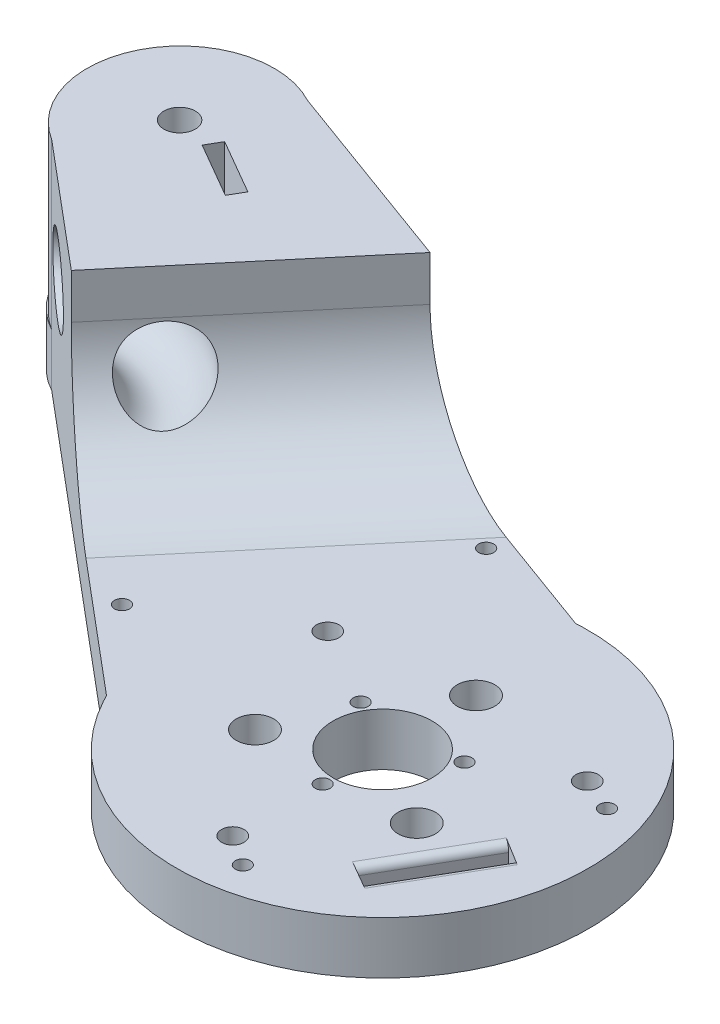
from build123d import *

# Parameters (mm, degrees)
SKETCH_1_R           = 27.5
SKETCH_1_R_2         = 6.6
SKETCH_1_R_3         = 1.3
EXTRUDE_1_DEPTH      = 7
SKETCH_2_R           = 2.5
CUT_EXTRUDE_2_DEPTH  = 5
SKETCH_4_R           = 1
CUT_EXTRUDE_3_DEPTH  = 6
SKETCH_5_R           = 1.5
CUT_EXTRUDE_4_DEPTH  = 50.019507543
CUT_EXTRUDE_5_DEPTH  = 2.7
CUT_EXTRUDE_6_DEPTH  = 10
FILLET_1_R           = 1
SKETCH_9_R           = 2.1
EXTRUDE_3_DEPTH      = 7
SKETCH_13_R          = 1
CUT_EXTRUDE_9_DEPTH  = 88.1614895
SKETCH_14_R          = 2.1
EXTRUDE_4_DEPTH      = 22
FILLET_2_R           = 16
SKETCH_15_R          = 1.5
CUT_EXTRUDE_10_DEPTH = 91.308323515
SKETCH_16_R          = 3
CUT_EXTRUDE_11_DEPTH = 3
SKETCH_17_R          = 5


with BuildPart() as part:
    # 草图1 → 凸台-拉伸1 (new body)
    with BuildSketch(Plane(origin=(0, 0, 0), x_dir=(1, 0, 0), z_dir=(0, 1, 0))):
        with Locations(Location((0, -12.470765814, 0), (0, 0, 270))):
            Circle(SKETCH_1_R)
        with Locations(Location((0, -12.470765814, 0), (0, 0, 270))):
            Circle(SKETCH_1_R_2, mode=Mode.SUBTRACT)
        with Locations(Location((-10.8, -18.706148722, 0), (0, 0, 270))):
            Circle(SKETCH_1_R_3, mode=Mode.SUBTRACT)
        with Locations(Location((10.8, -18.706148722, 0), (0, 0, 270))):
            Circle(SKETCH_1_R_3, mode=Mode.SUBTRACT)
        with Locations(Location((0, 0, 0), (0, 0, 270))):
            Circle(SKETCH_1_R_3, mode=Mode.SUBTRACT)
    extrude(amount=EXTRUDE_1_DEPTH)

    # 草图2 → 切除-拉伸2 (cut)
    with BuildSketch(Plane(origin=(0, 7, 0), x_dir=(1, 0, 0), z_dir=(0, 1, 0))):
        with Locations(Location((-10.8, -18.706148722, 0), (0, 0, 270))):
            Circle(SKETCH_2_R)
        with Locations(Location((10.8, -18.706148722, 0), (0, 0, 270))):
            Circle(SKETCH_2_R)
        with Locations(Location((0, 0, 0), (0, 0, 270))):
            Circle(SKETCH_2_R)
    extrude(amount=-CUT_EXTRUDE_2_DEPTH, mode=Mode.SUBTRACT)

    # 草图4 → 切除-拉伸3 (cut)
    with BuildSketch(Plane(origin=(0, 7, 0), x_dir=(1, 0, 0), z_dir=(0, 1, 0))):
        with Locations(Location((-6.92820323, -8.470765814, 0), (0, 0, 270))):
            Circle(SKETCH_4_R)
        with Locations(Location((6.92820323, -8.470765814, 0), (0, 0, 90))):
            Circle(SKETCH_4_R)
        with Locations(Location((0, -20.470765814, 0), (0, 0, 270))):
            Circle(SKETCH_4_R)
    extrude(amount=-CUT_EXTRUDE_3_DEPTH, mode=Mode.SUBTRACT)

    # 草图5 → 切除-拉伸4 (cut, through all)
    with BuildSketch(Plane(origin=(0, 7, 0), x_dir=(1, 0, 0), z_dir=(0, 1, 0))):
        with Locations(Location((-17.320508076, -2.470765814, 0), (0, 0, 270))):
            Circle(SKETCH_5_R)
        with Locations(Location((0, -32.470765814, 0), (0, 0, 270))):
            Circle(SKETCH_5_R)
        with Locations(Location((17.320508076, -2.470765814, 0), (0, 0, 270))):
            Circle(SKETCH_5_R)
    extrude(amount=-CUT_EXTRUDE_4_DEPTH, mode=Mode.SUBTRACT)

    # 草图6 → 切除-拉伸5 (cut)
    with BuildSketch(Plane.XZ):
        Polygon((3.290896534, 32.470765814), (1.645448267, 35.320765814), (-1.645448267, 35.320765814), (-3.290896534, 32.470765814), (-1.645448267, 29.620765814), (1.645448267, 29.620765814), align=None)
        Polygon((20.61140461, 2.470765814), (18.965956343, 5.320765814), (15.675059808, 5.320765814), (14.029611541, 2.470765814), (15.675059808, -0.379234186), (18.965956343, -0.379234186), align=None)
        Polygon((-14.029611541, 2.470765814), (-15.675059808, 5.320765814), (-18.965956343, 5.320765814), (-20.61140461, 2.470765814), (-18.965956343, -0.379234186), (-15.675059808, -0.379234186), align=None)
    extrude(amount=-CUT_EXTRUDE_5_DEPTH, mode=Mode.SUBTRACT)

    # 草图7 → 切除-拉伸6 (cut)
    with BuildSketch(Plane(origin=(0, 7, 0), x_dir=(1, 0, 0), z_dir=(0, 1, 0))):
        Polygon((19.338457268, -14.975575286), (11.838457268, -27.965956343), (14.003520778, -29.215956343), (21.468764488, -16.285774946), align=None)
    extrude(amount=-CUT_EXTRUDE_6_DEPTH, mode=Mode.SUBTRACT)

    # 圆角1
    fillet_1_edges = [part.edges().sort_by_distance(p)[0] for p in [
        (15.588457268, 0, 21.470765814),
        (17.736142633, 0, 22.750865644),
        (15.588457268, 7, 21.470765814),
        (17.736142633, 7, 22.750865644),
    ]]
    fillet(fillet_1_edges, radius=FILLET_1_R)

    # 草图9 → 凸台-拉伸3 (add)
    with BuildSketch(Plane.XZ):
        with BuildLine():
            Line((-24.637772228, 24.686746318), (-70.563132874, -13.924926133))
            ThreePointArc((-70.563132874, -13.924926133), (-75.458515455, -31.192547657), (-58.048161541, -35.553178381))
            Line((-58.048161541, -35.553178381), (-1.686469289, -14.977473133))
            Line((-1.686469289, -14.977473133), (-0.82500702, -15.016856189))
            Line((-0.82500702, -15.016856189), (-16.980808265, -9.160280176))
            Line((-16.980808265, -9.160280176), (-27.376809202, 9.870704679))
            Line((-27.376809202, 9.870704679), (-24.198243857, 25.535795253))
            Line((-24.198243857, 25.535795253), (-24.637772228, 24.686746318))
        make_face()
        with Locations(Location((-64.305647208, -24.739052257, 0), (0, 0, 270))):
            Circle(SKETCH_9_R, mode=Mode.SUBTRACT)
        Polygon((-58.808031517, -25.255019032), (-51.450927664, -20.997904645), (-52.552769035, -19.09371306), (-59.909872887, -23.350827447), align=None, mode=Mode.SUBTRACT)
    extrude(amount=-EXTRUDE_3_DEPTH)

    # 草图13 → 切除-拉伸9 (cut, through all)
    with BuildSketch(Plane(origin=(0, 7, 0), x_dir=(1, 0, 0), z_dir=(0, 1, 0))):
        with Locations(Location((4.029784687, -35.157765041, 0), (0, 0, 270))):
            Circle(SKETCH_13_R)
        with Locations(Location((21.824784687, -4.33592092, 0), (0, 0, 270))):
            Circle(SKETCH_13_R)
        with Locations(Location((-16.340954858, 17.69907908, 0), (0, 0, 270))):
            Circle(SKETCH_13_R)
        with Locations(Location((-34.135954858, -13.122765041, 0), (0, 0, 270))):
            Circle(SKETCH_13_R)
    extrude(amount=-CUT_EXTRUDE_9_DEPTH, mode=Mode.SUBTRACT)

    # 草图14 → 凸台-拉伸4 (add)
    with BuildSketch(Plane(origin=(0, 7, 0), x_dir=(1, 0, 0), z_dir=(0, 1, 0))):
        with BuildLine():
            Line((-70.563132874, 13.924926133), (-54.154588064, 0.129468707))
            Line((-54.154588064, 0.129468707), (-32.28086935, 26.146430855))
            Line((-32.28086935, 26.146430855), (-58.048161541, 35.553178381))
            ThreePointArc((-58.048161541, 35.553178381), (-74.791319703, 30.806481525), (-70.563132874, 13.924926133))
        make_face()
        with Locations(Location((-64.305647208, 24.739052257, 0), (0, 0, 90))):
            Circle(SKETCH_14_R, mode=Mode.SUBTRACT)
        Polygon((-58.808031517, 25.255019032), (-59.909872887, 23.350827447), (-52.552769035, 19.09371306), (-51.450927664, 20.997904645), align=None, mode=Mode.SUBTRACT)
    extrude(amount=EXTRUDE_4_DEPTH)

    # 圆角2
    fillet_2_edges = [part.edges().sort_by_distance(p)[0] for p in [
        (-43.217728707, 7, -13.137949781),
    ]]
    fillet(fillet_2_edges, radius=FILLET_2_R)

    # 草图15 → 切除-拉伸10 (cut, through all)
    with BuildSketch(Plane(origin=(-3.803339533, 0, 6.572894544), x_dir=(0.8655416297077619, 0, 0.5008369866961021), z_dir=(-0.5008369866961021, 0, 0.865541629707762))):
        with Locations(Location((-54.416791824, 23.665181086, 0), (0, 0, 245.053604138))):
            Circle(SKETCH_15_R)
    extrude(amount=-CUT_EXTRUDE_10_DEPTH, mode=Mode.SUBTRACT)

    # 草图16 → 切除-拉伸11 (cut)
    with BuildSketch(Plane(origin=(4.626421242, 0, -12.672855056), x_dir=(-0.9393615375389992, 0, -0.3429284207999792), z_dir=(0.3429284207999792, 0, -0.9393615375389992))):
        with Locations((53.038314469, 23.665181086)):
            Circle(SKETCH_16_R)
    extrude(amount=-CUT_EXTRUDE_11_DEPTH, mode=Mode.SUBTRACT)

    # 草图17 → 切除-旋转1 (revolve, cut)
    with BuildSketch(Plane(origin=(-31.791422565, 0, -26.728586941), x_dir=(0.6435278741872098, 0, -0.7654226774430521), z_dir=(0.7654226774430521, 0, 0.6435278741872098)), mode=Mode.PRIVATE) as cut_revolve_1_sk:
        with Locations((-25.901195998, 17.59703733)):
            Circle(SKETCH_17_R)
    revolve(cut_revolve_1_sk.sketch.rotate(Axis((-59.195395552, 24.020808836, 5.866150937), (0, -1, 0)), 329.642648375), axis=Axis((-59.195395552, 24.020808836, 5.866150937), (0, -1, 0)), mode=Mode.SUBTRACT)


solid = part.part
